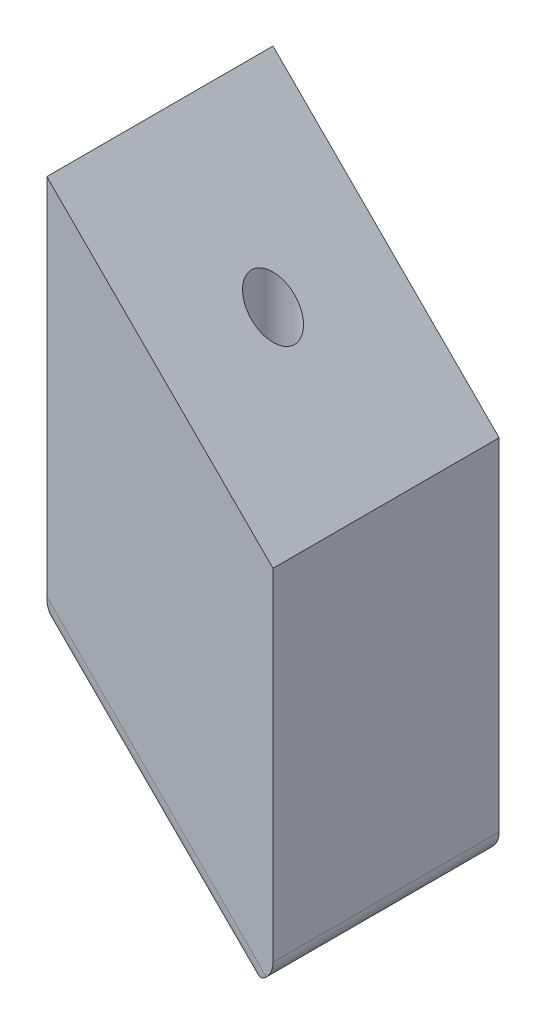
from build123d import *

# Parameters (mm, degrees)
SKETCH1_W           = 20
SKETCH1_H           = 20
BOSS_EXTRUDE1_DEPTH = 15
BOSS_EXTRUDE2_DEPTH = 20
CUT_EXTRUDE1_DEPTH  = 42.533119315
SKETCH4_R           = 1.905
CUT_EXTRUDE2_DEPTH  = 43.426406871
BOSS_EXTRUDE3_DEPTH = 4
BOSS_EXTRUDE4_DEPTH = 4
FILLET1_R           = 2


with BuildPart() as part:
    # Sketch1 → Boss-Extrude1 (new body)
    with BuildSketch(Plane(origin=(0, 0, 0), x_dir=(1, 0, 0), z_dir=(0, 1, 0))):
        Rectangle(SKETCH1_W, SKETCH1_H)
    extrude(amount=BOSS_EXTRUDE1_DEPTH)

    # Sketch2 → Boss-Extrude2 (add)
    with BuildSketch(Plane.XY.offset(10)):
        Polygon((10, 15), (-10, 35), (-10, 15), align=None)
        Polygon((-10, 0), (10, -20), (10, 0), align=None)
    extrude(amount=-BOSS_EXTRUDE2_DEPTH)

    # Sketch3 → Cut-Extrude1 (cut, through all)
    with BuildSketch(Plane(origin=(0, 0, -10), x_dir=(-1, 0, 0), z_dir=(0, 0, -1))):
        Polygon((-5, -15), (-5, -5), (5, -5), align=None)
    extrude(amount=-CUT_EXTRUDE1_DEPTH, mode=Mode.SUBTRACT)

    # Sketch4 → Cut-Extrude2 (cut, through all)
    with BuildSketch(Plane.XZ.offset(5)):
        Circle(SKETCH4_R)
    extrude(amount=-CUT_EXTRUDE2_DEPTH, mode=Mode.SUBTRACT)

    # Sketch5 → Boss-Extrude3 (add)
    with BuildSketch(Plane.XY.offset(10)):
        Polygon((5, -5), (5, -15), (-5, -5), align=None)
    extrude(amount=-BOSS_EXTRUDE3_DEPTH)

    # Sketch6 → Boss-Extrude4 (add)
    with BuildSketch(Plane(origin=(0, 0, -10), x_dir=(-1, 0, 0), z_dir=(0, 0, -1))):
        Polygon((5, -5), (-5, -5), (-5, -15), align=None)
    extrude(amount=-BOSS_EXTRUDE4_DEPTH)

    # Fillet1
    fillet1_edges = [part.edges().sort_by_distance(p)[0] for p in [
        (10, -20, 0),
        (0, -10, 10),
        (0, -10, -10),
        (-10, 0, 0),
    ]]
    fillet(fillet1_edges, radius=FILLET1_R)


solid = part.part
